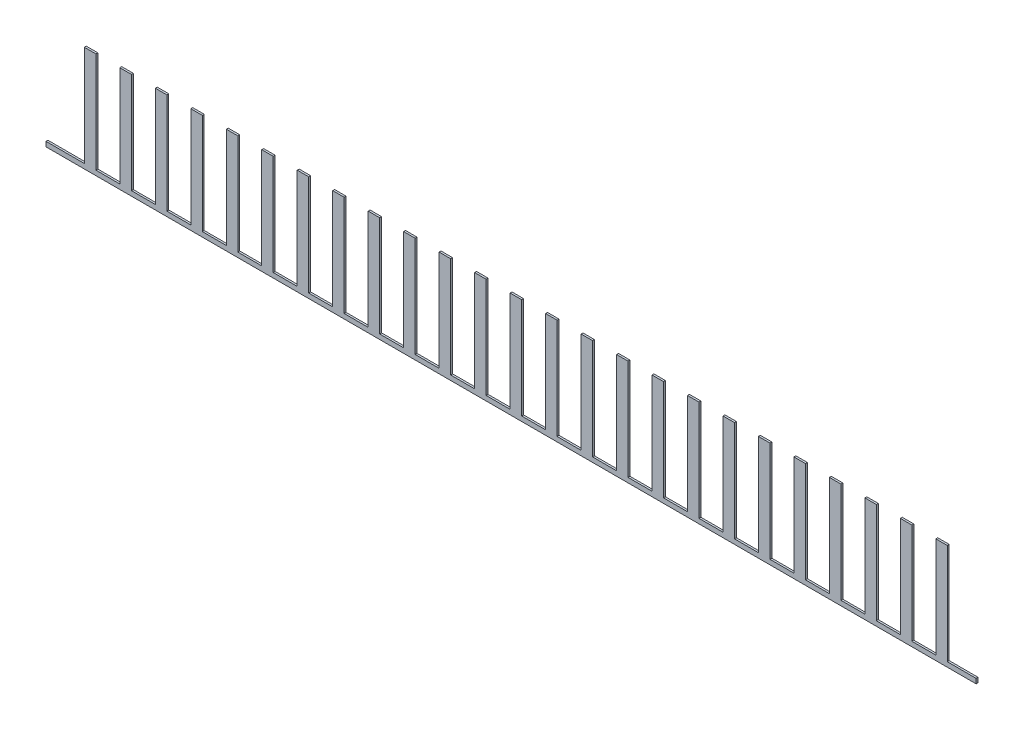
from build123d import *

# Parameters (mm, degrees)
BOSS_EXTRUDE1_DEPTH = 2


with BuildPart() as part:
    # Sketch1 → Boss-Extrude1 (new body)
    with BuildSketch(Plane.XY):
        Polygon((-481.45546786, 0), (478.54453214, 0), (478.54453214, 5), (448.54453214, 5), (448.54453214, 110), (436.54453214, 110), (436.54453214, 5), (411.54453214, 5), (411.54453214, 110), (399.54453214, 110), (399.54453214, 5), (374.54453214, 5), (374.54453214, 110), (362.54453214, 110), (362.54453214, 5), (337.54453214, 5), (337.54453214, 110), (325.54453214, 110), (325.54453214, 5), (300.54453214, 5), (300.54453214, 110), (288.54453214, 110), (288.54453214, 5), (263.54453214, 5), (263.54453214, 110), (251.54453214, 110), (251.54453214, 5), (226.54453214, 5), (226.54453214, 110), (214.54453214, 110), (214.54453214, 5), (189.54453214, 5), (189.54453214, 110), (177.54453214, 110), (177.54453214, 5), (152.54453214, 5), (152.54453214, 110), (140.54453214, 110), (140.54453214, 5), (115.54453214, 5), (115.54453214, 110), (103.54453214, 110), (103.54453214, 5), (78.54453214, 5), (78.54453214, 110), (66.54453214, 110), (66.54453214, 5), (41.54453214, 5), (41.54453214, 110), (29.54453214, 110), (29.54453214, 5), (4.54453214, 5), (4.54453214, 110), (-7.45546786, 110), (-7.45546786, 5), (-32.45546786, 5), (-32.45546786, 110), (-44.45546786, 110), (-44.45546786, 5), (-69.45546786, 5), (-69.45546786, 110), (-81.45546786, 110), (-81.45546786, 5), (-106.45546786, 5), (-106.45546786, 110), (-118.45546786, 110), (-118.45546786, 5), (-143.45546786, 5), (-143.45546786, 110), (-155.45546786, 110), (-155.45546786, 5), (-180.45546786, 5), (-180.45546786, 110), (-192.45546786, 110), (-192.45546786, 5), (-217.45546786, 5), (-217.45546786, 110), (-229.45546786, 110), (-229.45546786, 5), (-254.45546786, 5), (-254.45546786, 110), (-266.45546786, 110), (-266.45546786, 5), (-291.45546786, 5), (-291.45546786, 110), (-303.45546786, 110), (-303.45546786, 5), (-328.45546786, 5), (-328.45546786, 110), (-340.45546786, 110), (-340.45546786, 5), (-365.45546786, 5), (-365.45546786, 110), (-377.45546786, 110), (-377.45546786, 5), (-402.45546786, 5), (-402.45546786, 110), (-414.45546786, 110), (-414.45546786, 5), (-439.45546786, 5), (-439.45546786, 110), (-451.45546786, 110), (-451.45546786, 5), (-491.45546786, 5), (-491.45546786, 0), align=None)
    extrude(amount=BOSS_EXTRUDE1_DEPTH)


solid = part.part
